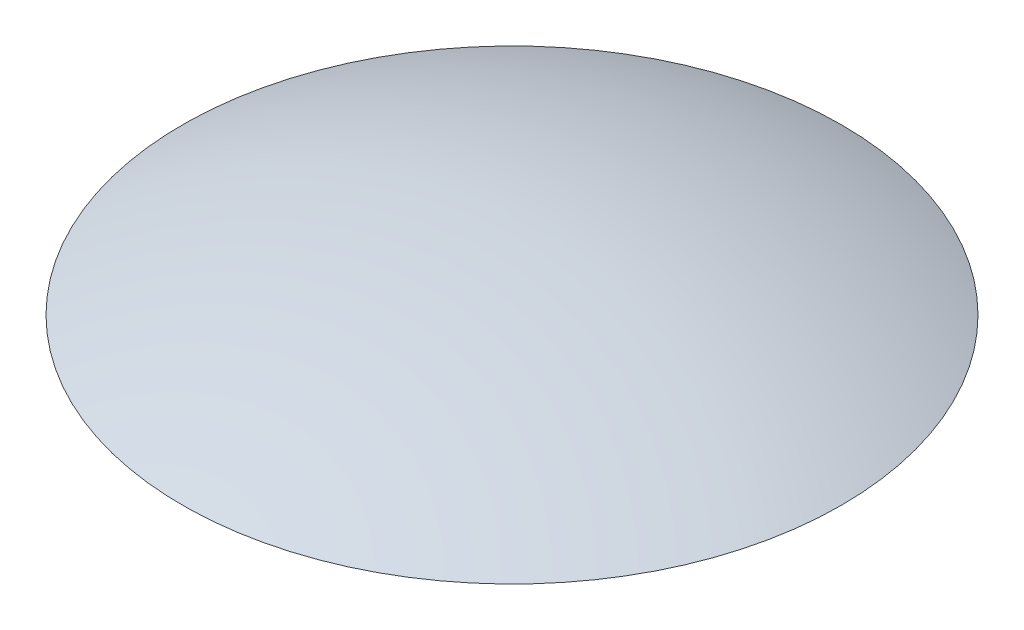
from build123d import *


with BuildPart() as part:
    # 草图1 → 旋转1 (revolve)
    with BuildSketch(Plane.XY):
        with BuildLine():
            Line((4.049691346, 15.27219696), (7, 15.27219696))
            ThreePointArc((7, 15.27219696), (3.582393827, 16.413605773), (0, 16.8))
            Line((0, 16.8), (0, 15.8))
            ThreePointArc((0, 15.8), (2.04197062, 15.667493609), (4.049691346, 15.27219696))
        make_face()
    revolve(axis=Axis((0, 0, 0), (0, 1, 0)))


solid = part.part
